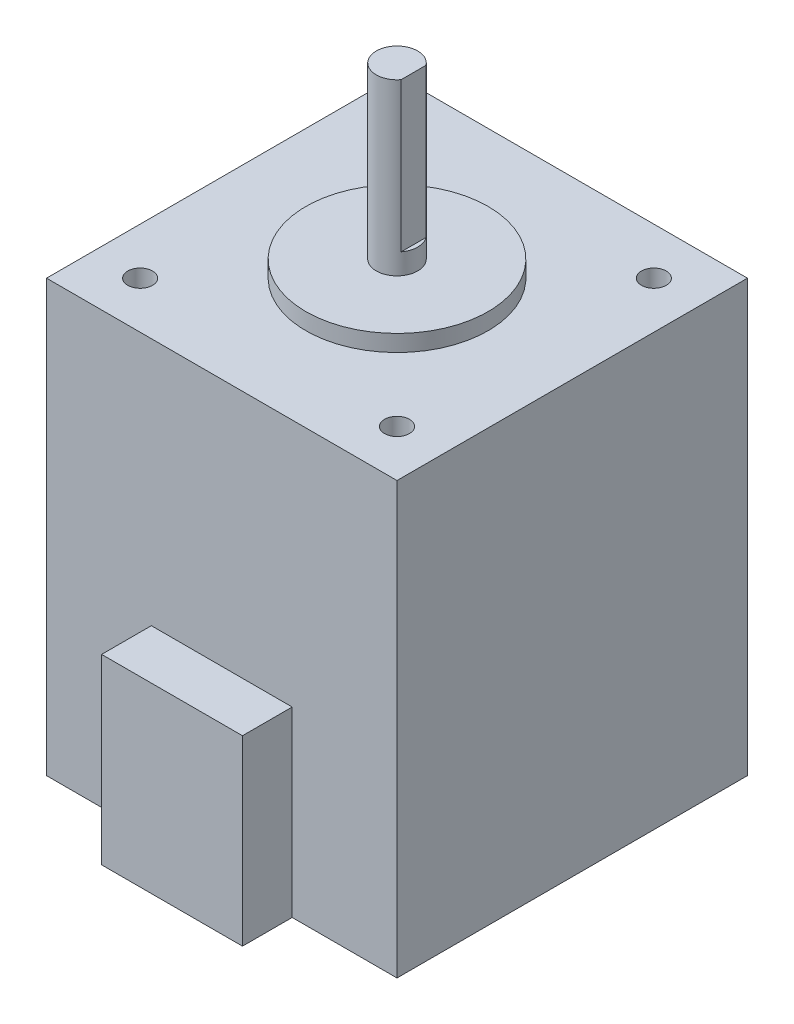
from build123d import *

# Parameters (mm, degrees)
SKETCH_1_W          = 42.3
SKETCH_1_H          = 42.3
EXTRUDE_1_DEPTH     = 52
SKETCH_2_R          = 1.5
CUT_EXTRUDE_1_DEPTH = 4
SKETCH_3_R          = 11
EXTRUDE_2_DEPTH     = 2
SKETCH_4_R          = 2.5
EXTRUDE_3_DEPTH     = 20.5
CUT_EXTRUDE_START   = -18
CUT_EXTRUDE_4_DEPTH = 18
SKETCH_6_W          = 17
SKETCH_6_H          = 22
EXTRUDE_4_DEPTH     = 6


with BuildPart() as part:
    # 草图1 → 凸台-拉伸1 (new body)
    with BuildSketch(Plane(origin=(0, 0, 0), x_dir=(1, 0, 0), z_dir=(0, 1, 0))):
        Rectangle(SKETCH_1_W, SKETCH_1_H)
    extrude(amount=EXTRUDE_1_DEPTH)

    # 草图2 → 切除-拉伸1 (cut)
    with BuildSketch(Plane(origin=(0, 52, 0), x_dir=(1, 0, 0), z_dir=(0, 1, 0))):
        with Locations(Location((-15.5, 15.5, 0), (0, 0, 270))):
            Circle(SKETCH_2_R)
        with Locations(Location((15.5, 15.5, 0), (0, 0, 270))):
            Circle(SKETCH_2_R)
        with Locations(Location((15.5, -15.5, 0), (0, 0, 270))):
            Circle(SKETCH_2_R)
        with Locations(Location((-15.5, -15.5, 0), (0, 0, 270))):
            Circle(SKETCH_2_R)
    extrude(amount=-CUT_EXTRUDE_1_DEPTH, mode=Mode.SUBTRACT)

    # 草图3 → 凸台-拉伸2 (add)
    with BuildSketch(Plane(origin=(0, 52, 0), x_dir=(1, 0, 0), z_dir=(0, 1, 0))):
        with Locations(Location((0, 0, 0), (0, 0, 90))):
            Circle(SKETCH_3_R)
    extrude(amount=EXTRUDE_2_DEPTH)

    # 草图4 → 凸台-拉伸3 (add)
    with BuildSketch(Plane(origin=(0, 54, 0), x_dir=(1, 0, 0), z_dir=(0, 1, 0))):
        with Locations(Location((0, 0, 0), (0, 0, 270))):
            Circle(SKETCH_4_R)
    extrude(amount=EXTRUDE_3_DEPTH)

    # 草图5 → 切除-拉伸4 (cut)
    with BuildSketch(Plane(origin=(0, 74.5, 0), x_dir=(1, 0, 0), z_dir=(0, 1, 0)).offset(CUT_EXTRUDE_START)):
        with BuildLine():
            Line((2, 1.5), (2, -1.5))
            ThreePointArc((2, -1.5), (2.5, 0), (2, 1.5))
        make_face()
    extrude(amount=CUT_EXTRUDE_4_DEPTH, mode=Mode.SUBTRACT)

    # 草图6 → 凸台-拉伸4 (add)
    with BuildSketch(Plane.XY.offset(21.15)):
        with Locations((0, 11)):
            Rectangle(SKETCH_6_W, SKETCH_6_H)
    extrude(amount=EXTRUDE_4_DEPTH)


solid = part.part
